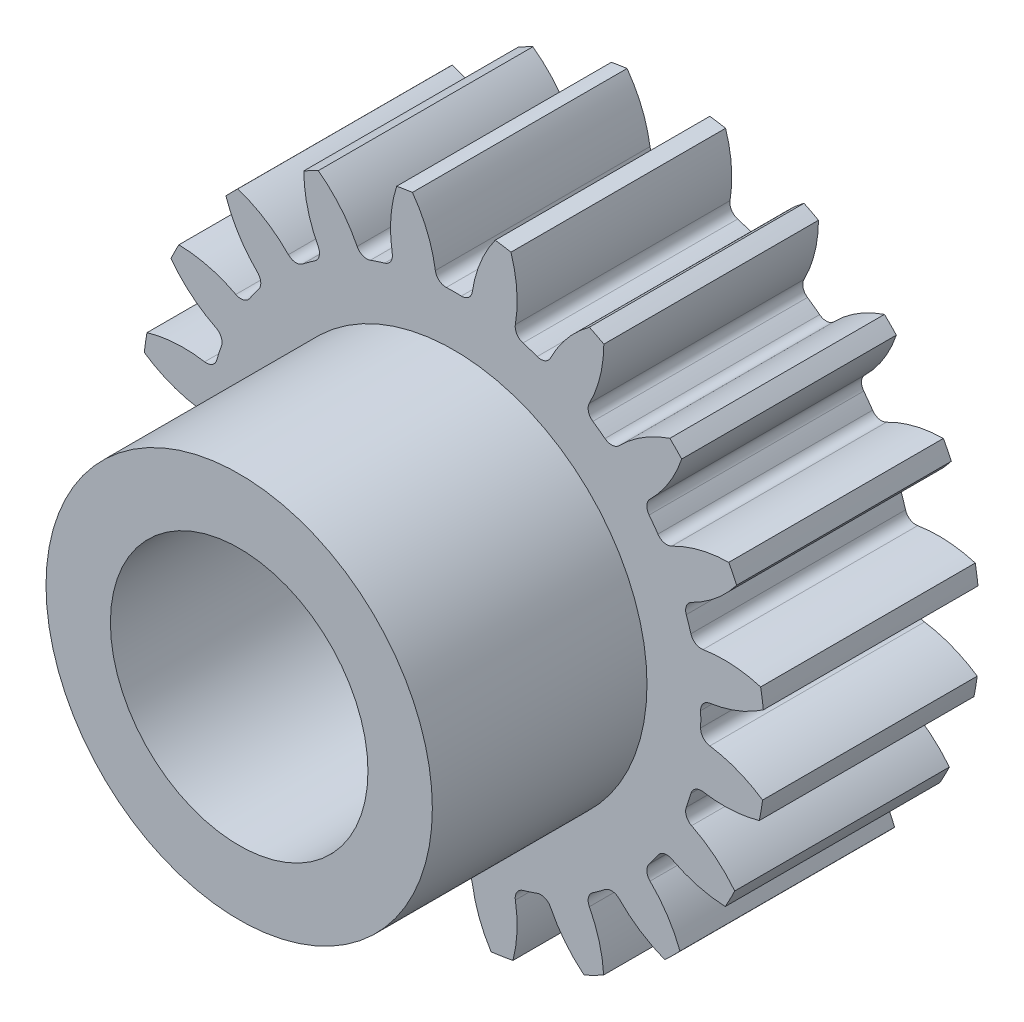
from build123d import *
from build123d.topology import SkipClean

# Parameters (mm, degrees)
SKETCH1_R                = 3.63
BOSS_EXTRUDE1_DEPTH      = 2.5
CUT_EXTRUDE1_DEPTH       = 2.5
FILLET1_R                = 0.1254
CIRPATTERN1_COUNT        = 20
FILLET1_OF_CIRPATTERN1_R = 0.1254
CUT_EXTRUDE2_DEPTH       = 2.5
BOSS_EXTRUDE2_START      = 2.5
SKETCH4_R                = 2.25
SKETCH4_R_2              = 1.5
BOSS_EXTRUDE2_DEPTH      = 2.5


with BuildPart() as part:
    # Sketch1 → Boss-Extrude1 (new body)
    with BuildSketch(Plane.XY):
        Circle(SKETCH1_R)
    extrude(amount=BOSS_EXTRUDE1_DEPTH)

    # Sketch2 → Cut-Extrude1 (cut)
    with BuildSketch(Plane.XY):
        with BuildLine():
            ThreePointArc((0.481938392, 3.597865393), (0, 3.63), (-0.481938392, 3.597865393))
            ThreePointArc((-0.481938392, 3.597865393), (-0.288758173, 3.23380785), (-0.202731128, 2.83074974))
            ThreePointArc((-0.202731128, 2.83074974), (0, 2.838), (0.202731128, 2.83074974))
            ThreePointArc((0.202731128, 2.83074974), (0.288758173, 3.23380785), (0.481938392, 3.597865393))
        make_face()
    cut_extrude1 = extrude(amount=CUT_EXTRUDE1_DEPTH, mode=Mode.SUBTRACT)

    # Fillet1
    fillet1_edges = [part.edges().sort_by_distance(p)[0] for p in [
        (-0.202731128, 2.83074974, 1.25),
        (0.202731128, 2.83074974, 1.25),
    ]]
    fillet(fillet1_edges, radius=FILLET1_R)

    # CirPattern1: Cut-Extrude1 ×20 about axis
    cirpattern1_axis = Axis((0, -0.038316641, 0), (0, 0, 1))
    for i in range(1, CIRPATTERN1_COUNT):
        add(cut_extrude1.rotate(cirpattern1_axis, i * 360 / CIRPATTERN1_COUNT), mode=Mode.SUBTRACT)

    # Fillet1 of CirPattern1
    fillet1_of_cirpattern1_edges = [part.edges().sort_by_distance(p)[0] for p in [
        (-1.07939903, 2.627680272, 1.25),
        (-0.693781509, 2.752975, 1.25),
        (-1.850407834, 2.163644452, 1.25),
        (-1.522381978, 2.401969187, 1.25),
        (-2.440285827, 1.484065338, 1.25),
        (-2.201961092, 1.812091194, 1.25),
        (-2.791291641, 0.655464868, 1.25),
        (-2.665996913, 1.04108239, 1.25),
        (-2.86906638, -0.241047769, 1.25),
        (-2.86906638, 0.164414488, 1.25),
        (-2.665996913, -1.117715671, 1.25),
        (-2.791291641, -0.73209815, 1.25),
        (-2.201961092, -1.888724475, 1.25),
        (-2.440285827, -1.560698619, 1.25),
        (-1.522381978, -2.478602468, 1.25),
        (-1.850407834, -2.240277733, 1.25),
        (-0.693781509, -2.829608281, 1.25),
        (-1.07939903, -2.704313553, 1.25),
        (0.202731128, -2.907383021, 1.25),
        (-0.202731128, -2.907383021, 1.25),
        (1.07939903, -2.704313553, 1.25),
        (0.693781509, -2.829608281, 1.25),
        (1.850407834, -2.240277733, 1.25),
        (1.522381978, -2.478602468, 1.25),
        (2.440285827, -1.560698619, 1.25),
        (2.201961092, -1.888724475, 1.25),
        (2.791291641, -0.73209815, 1.25),
        (2.665996913, -1.117715671, 1.25),
        (2.86906638, 0.164414488, 1.25),
        (2.86906638, -0.241047769, 1.25),
        (2.665996913, 1.04108239, 1.25),
        (2.791291641, 0.655464868, 1.25),
        (2.201961092, 1.812091194, 1.25),
        (2.440285827, 1.484065338, 1.25),
        (1.522381978, 2.401969187, 1.25),
        (1.850407834, 2.163644452, 1.25),
        (0.693781509, 2.752975, 1.25),
        (1.07939903, 2.627680272, 1.25),
    ]]
    fillet(fillet1_of_cirpattern1_edges, radius=FILLET1_OF_CIRPATTERN1_R)

    # Sketch3 → Cut-Extrude2 (cut)
    with BuildSketch(Plane.XY.offset(2.5)):
        with BuildLine():
            Line((-1.118033989, 1), (1.118033989, 1))
            ThreePointArc((1.118033989, 1), (0, -1.5), (-1.118033989, 1))
        make_face()
    extrude(amount=-CUT_EXTRUDE2_DEPTH, mode=Mode.SUBTRACT)

    # Sketch4 → Boss-Extrude2 (add)
    with SkipClean():  # the faces are left unmerged after this step: merging them gives an invalid solid
        with BuildSketch(Plane.XY.offset(2.5).offset(BOSS_EXTRUDE2_START)):
            Circle(SKETCH4_R)
            Circle(SKETCH4_R_2, mode=Mode.SUBTRACT)
        extrude(amount=-BOSS_EXTRUDE2_DEPTH)


solid = part.part
